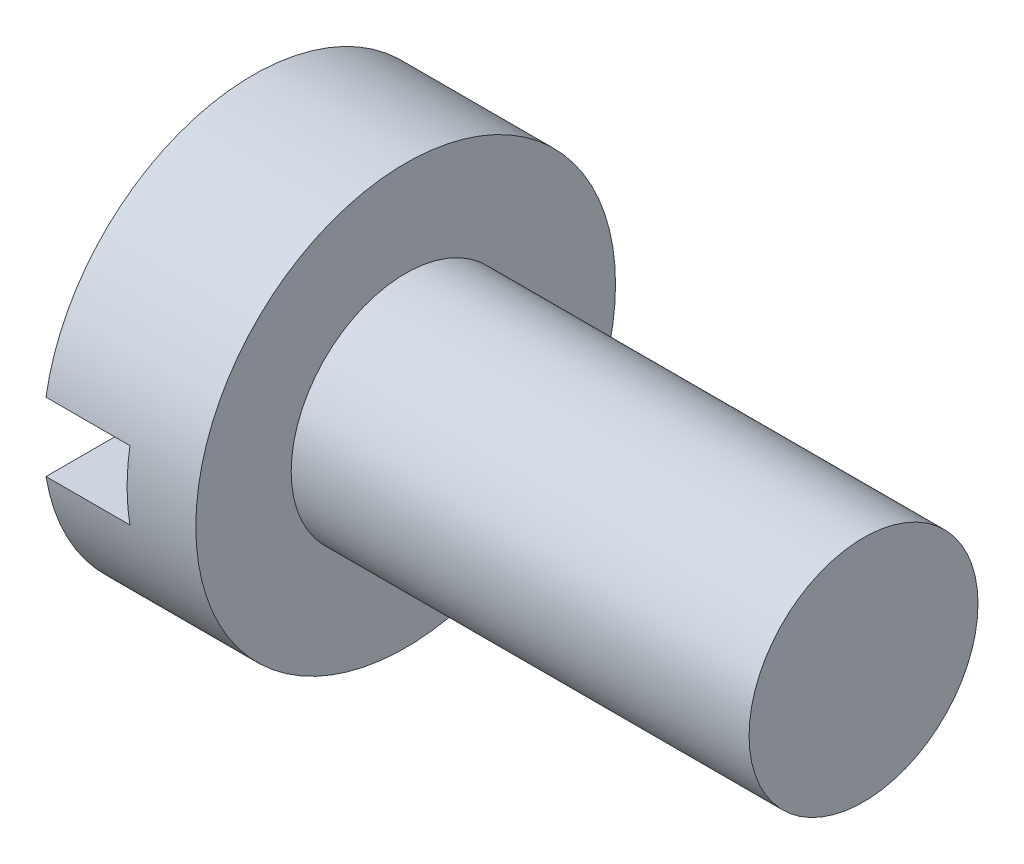
from build123d import *

# Parameters (mm, degrees)
SKETCH2_W  = 5.5
SKETCH2_H  = 0.9
SLOT_DEPTH = 1.1


with BuildPart() as part:
    # BodySke → Base-Revolve (revolve)
    with BuildSketch(Plane.XY, mode=Mode.PRIVATE) as base_revolve_sk:
        Polygon((2, 1.5), (2, 2.75), (0, 2.75), (0, 0), (8, 0), (8, 1.5), align=None)
    revolve(base_revolve_sk.sketch.rotate(Axis((-25.4, 0, 0), (1, 0, 0)), 90), axis=Axis((-25.4, 0, 0), (1, 0, 0)))

    # Sketch2 → Slot (cut)
    with BuildSketch(Plane(origin=(0, 0, 0), x_dir=(0, 0, -1), z_dir=(1, 0, 0))):
        Rectangle(SKETCH2_W, SKETCH2_H)
    extrude(amount=SLOT_DEPTH, mode=Mode.SUBTRACT)


solid = part.part
